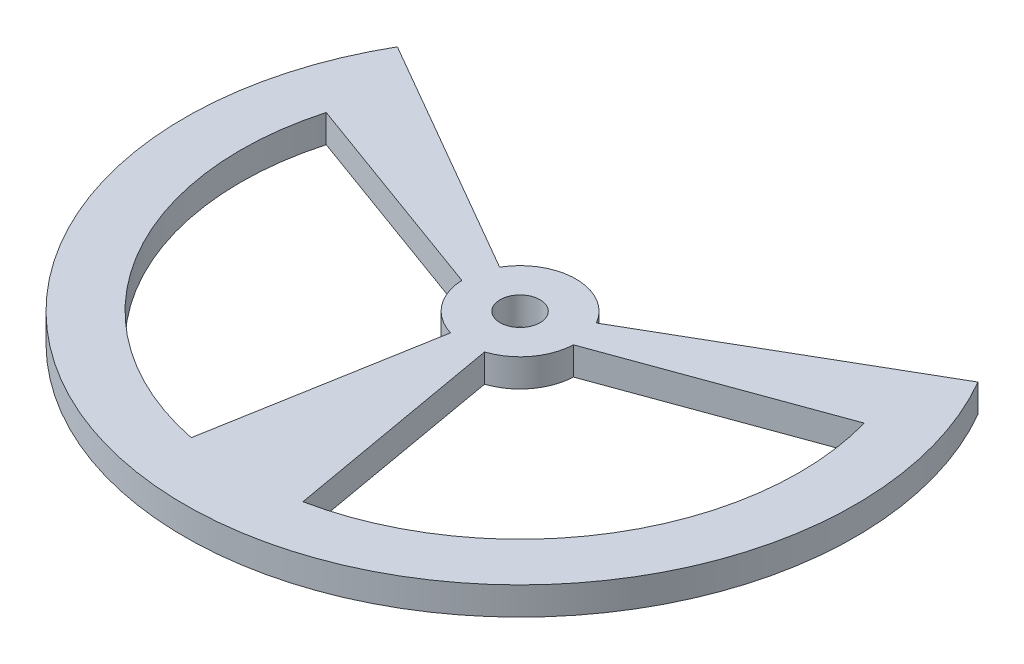
from build123d import *

# Parameters (mm, degrees)
EXTRUDE1_DEPTH = 12.7
EXTRUDE2_DEPTH = 216.9
SKETCH8_R      = 9.07761974
EXTRUDE3_DEPTH = 216.9


with BuildPart() as part:
    # Sketch1 → Extrude1 (new body)
    with BuildSketch(Plane(origin=(0, 0, 0), x_dir=(1, 0, 0), z_dir=(0, 1, 0))):
        with BuildLine():
            Line((-131.982271537, 76.2), (-21.997045256, 12.7))
            ThreePointArc((-21.997045256, 12.7), (0, 25.4), (21.997045256, 12.7))
            Line((21.997045256, 12.7), (131.982271537, 76.2))
            ThreePointArc((131.982271537, 76.2), (0, -152.4), (-131.982271537, 76.2))
        make_face()
    extrude(amount=EXTRUDE1_DEPTH)

    # Sketch2 → Extrude2 (cut, through all)
    with BuildSketch(Plane(origin=(0, 12.7, 0), x_dir=(1, 0, 0), z_dir=(0, 1, 0))):
        with BuildLine():
            Line((-122.312523376, 34.185473895), (-25.376324988, -1.096416941))
            ThreePointArc((-25.376324988, -1.096416941), (-20.043874739, -15.601380882), (-7.29146874, -24.33093676))
            Line((-7.29146874, -24.33093676), (-24.958114169, -124.523461794))
            ThreePointArc((-24.958114169, -124.523461794), (-108.255677623, -66.405634267), (-122.312523376, 34.185473895))
        make_face()
        with BuildLine():
            Line((25.376324988, -1.096416941), (122.312523376, 34.185473895))
            ThreePointArc((122.312523376, 34.185473895), (108.43851372, -66.106646732), (25.644983679, -124.38382054))
            Line((25.644983679, -124.38382054), (7.965532589, -24.118670995))
            ThreePointArc((7.965532589, -24.118670995), (20.258971151, -15.321034165), (25.376324988, -1.096416941))
        make_face()
    extrude(amount=-EXTRUDE2_DEPTH, mode=Mode.SUBTRACT)

    # Sketch8 → Extrude3 (cut, through all)
    with BuildSketch(Plane.XZ):
        with Locations(Location((0, 0, 0), (0, 0, 270))):
            Circle(SKETCH8_R)
    extrude(amount=-EXTRUDE3_DEPTH, mode=Mode.SUBTRACT)


solid = part.part
